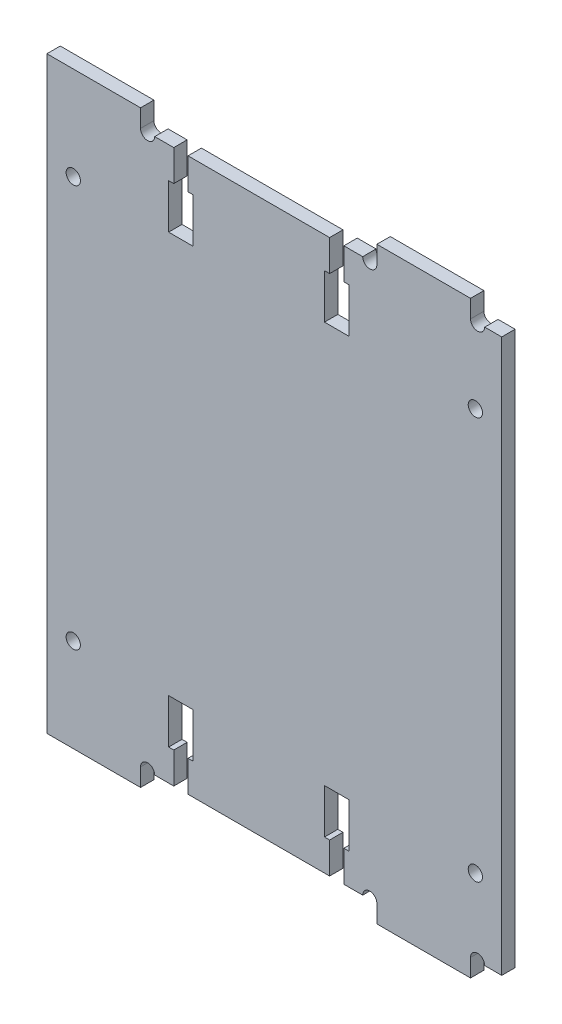
from build123d import *

# Parameters (mm, degrees)
MODEL_R             = 1.6
BOSS_EXTRUDE1_DEPTH = 3
SKETCH2_R           = 1.59
CUT_EXTRUDE1_DEPTH  = 135.365174059


with BuildPart() as part:
    # Model → Boss-Extrude1 (new body)
    with BuildSketch(Plane.XY):
        Polygon((110, -66), (110, -62), (117, -62), (117, 62), (110, 62), (110, 66), (89, 66), (89, 62), (81.6, 62), (81.6, 55), (82.75, 55), (82.75, 45), (77.25, 45), (77.25, 55), (78.4, 55), (78.4, 62), (46.65, 62), (46.65, 55), (47.8, 55), (47.8, 45), (42.3, 45), (42.3, 55), (43.45, 55), (43.45, 62), (36, 62), (36, 66), (15, 66), (15, -66), (36, -66), (36, -62), (43.45, -62), (43.45, -55), (42.3, -55), (42.3, -45), (47.8, -45), (47.8, -55), (46.65, -55), (46.65, -62), (78.4, -62), (78.4, -55), (77.25, -55), (77.25, -45), (82.75, -45), (82.75, -55), (81.6, -55), (81.6, -62), (89, -62), (89, -66), align=None)
        with Locations((111.085, -45.085)):
            Circle(MODEL_R, mode=Mode.SUBTRACT)
        with Locations((111.085, 45.085)):
            Circle(MODEL_R, mode=Mode.SUBTRACT)
        with Locations((20.915, 45.085)):
            Circle(MODEL_R, mode=Mode.SUBTRACT)
        with Locations((20.915, -45.085)):
            Circle(MODEL_R, mode=Mode.SUBTRACT)
    extrude(amount=BOSS_EXTRUDE1_DEPTH)

    # Sketch2 → Cut-Extrude1 (cut, through all)
    with BuildSketch(Plane.XY.offset(3)):
        with Locations((37.59, 62)):
            Circle(SKETCH2_R)
        with Locations((87.41, 62)):
            Circle(SKETCH2_R)
        with Locations((37.59, -62)):
            Circle(SKETCH2_R)
        with Locations((87.41, -62)):
            Circle(SKETCH2_R)
        with Locations((111.59, -62)):
            Circle(SKETCH2_R)
        with Locations((111.59, 62)):
            Circle(SKETCH2_R)
    extrude(amount=-CUT_EXTRUDE1_DEPTH, mode=Mode.SUBTRACT)


solid = part.part
